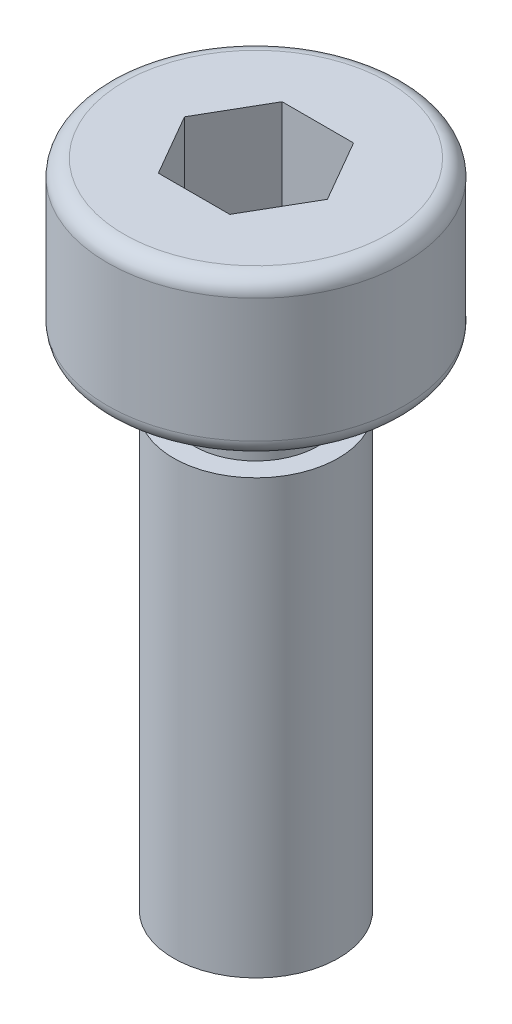
from build123d import *

# Parameters (mm, degrees)
CUT_EXTRUDE_1_DEPTH = 2.8


with BuildPart() as part:
    # 草图1 → 旋转1 (revolve)
    with BuildSketch(Plane.XY, mode=Mode.PRIVATE) as revolve_1_sk:
        with BuildLine():
            Line((0, 15.8), (-3.2, 15.8))
            ThreePointArc((-3.2, 15.8), (-3.482842712, 15.682842712), (-3.6, 15.4))
            Line((-3.6, 15.4), (-3.6, 12.4))
            ThreePointArc((-3.6, 12.4), (-3.482842712, 12.117157288), (-3.2, 12))
            Line((-3.2, 12), (-1.5, 12))
            Line((-1.5, 12), (-1.5, 10.5))
            Line((-1.5, 10.5), (-2, 10.5))
            Line((-2, 10.5), (-2, 0))
            Line((-2, 0), (0, 0))
            Line((0, 0), (0, 15.8))
        make_face()
    revolve(revolve_1_sk.sketch.rotate(Axis((0, 0, 0), (0, 1, 0)), 270), axis=Axis((0, 0, 0), (0, 1, 0)))

    # 草图2 → 切除-拉伸1 (cut)
    with BuildSketch(Plane(origin=(0, 15.8, 0), x_dir=(1, 0, 0), z_dir=(0, 1, 0))):
        Polygon((-0.866025404, 1.5), (-1.732050808, 0), (-0.866025404, -1.5), (0.866025404, -1.5), (1.732050808, 0), (0.866025404, 1.5), align=None)
    extrude(amount=-CUT_EXTRUDE_1_DEPTH, mode=Mode.SUBTRACT)


solid = part.part
